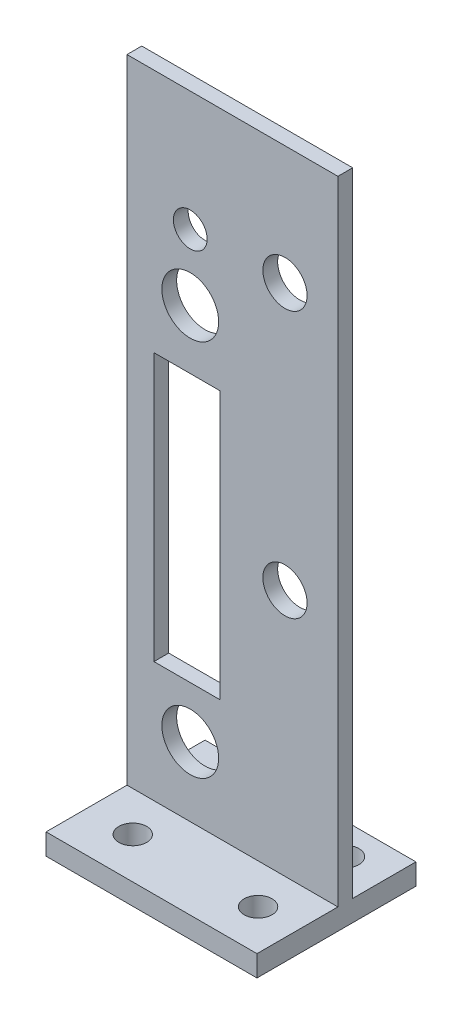
from build123d import *

# Parameters (mm, degrees)
SKETCH_1_W          = 50
SKETCH_1_H          = 150
EXTRUDE_1_DEPTH     = 3.5
SKETCH_8_W          = 50
SKETCH_8_H          = 15
SKETCH_8_H_2        = 3.5
SKETCH_8_H_3        = 19.185479081
EXTRUDE_3_DEPTH     = 5
SKETCH_9_R          = 3.302
CUT_EXTRUDE_7_DEPTH = 5
SKETCH_10_R         = 6.731
SKETCH_10_R_2       = 4
SKETCH_10_W         = 15.687252276
SKETCH_10_H         = 63.430283682
CUT_EXTRUDE_8_DEPTH = 10
SKETCH_5_R          = 5.24
CUT_EXTRUDE_9_DEPTH = 10


with BuildPart() as part:
    # 草图1 → 凸台-拉伸1 (new body)
    with BuildSketch(Plane.XY):
        with Locations((1.67844523, -33.188535046)):
            Rectangle(SKETCH_1_W, SKETCH_1_H)
    extrude(amount=EXTRUDE_1_DEPTH)

    # 草图8 → 凸台-拉伸3 (add)
    with BuildSketch(Plane.XZ.offset(108.188535046)):
        with Locations((1.67844523, -7.5)):
            Rectangle(SKETCH_8_W, SKETCH_8_H)
        with Locations((1.67844523, 1.75)):
            Rectangle(SKETCH_8_W, SKETCH_8_H_2)
        with Locations((1.67844523, 13.092739541)):
            Rectangle(SKETCH_8_W, SKETCH_8_H_3)
    extrude(amount=EXTRUDE_3_DEPTH)

    # 草图9 → 切除-拉伸7 (cut)
    with BuildSketch(Plane(origin=(0, -108.188535046, 0), x_dir=(1, 0, 0), z_dir=(0, 1, 0))):
        with Locations(Location((-12.522466831, 7.672144746, 0), (0, 0, 270))):
            Circle(SKETCH_9_R)
        with Locations(Location((17.187336033, 7.672144746, 0), (0, 0, 270))):
            Circle(SKETCH_9_R)
        with Locations(Location((-12.522466831, -12.928520448, 0), (0, 0, 270))):
            Circle(SKETCH_9_R)
        with Locations(Location((17.187336033, -12.928520448, 0), (0, 0, 270))):
            Circle(SKETCH_9_R)
    extrude(amount=-CUT_EXTRUDE_7_DEPTH, mode=Mode.SUBTRACT)

    # 草图10 → 切除-拉伸8 (cut)
    with BuildSketch(Plane.XY.offset(3.5)):
        with Locations((-8.32155477, -91.802996241)):
            Circle(SKETCH_10_R)
        with Locations((-8.32155477, -2.202996241)):
            Circle(SKETCH_10_R)
        with Locations((-8.32155477, 13.397003759)):
            Circle(SKETCH_10_R_2)
        with Locations((-9.087030569, -47.911053293)):
            Rectangle(SKETCH_10_W, SKETCH_10_H)
    extrude(amount=-CUT_EXTRUDE_8_DEPTH, mode=Mode.SUBTRACT)

    # 草图5 → 切除-拉伸9 (cut)
    with BuildSketch(Plane.XY.offset(3.5)):
        with Locations((14.135684743, 13.64917749)):
            Circle(SKETCH_5_R)
        with Locations((14.135684743, -49.462755876)):
            Circle(SKETCH_5_R)
    extrude(amount=-CUT_EXTRUDE_9_DEPTH, mode=Mode.SUBTRACT)


solid = part.part
